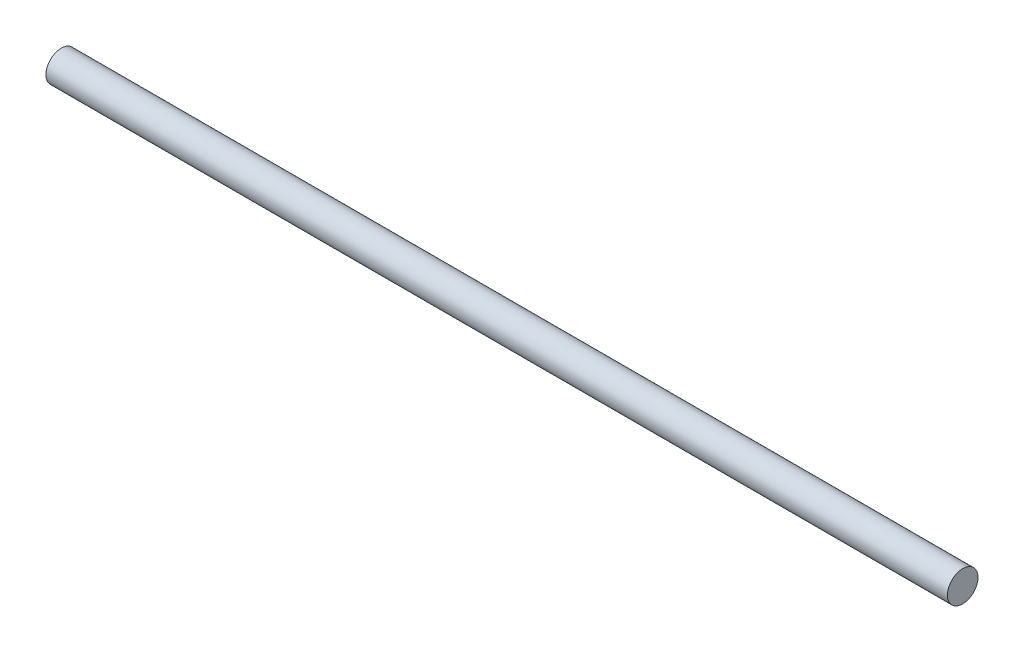
from build123d import *

# Parameters (mm, degrees)
SKETCH1_R           = 1.5
BOSS_EXTRUDE1_DEPTH = 88.49


with BuildPart() as part:
    # Sketch1 → Boss-Extrude1 (new body)
    with BuildSketch(Plane(origin=(0, 0, 0), x_dir=(0, 0, -1), z_dir=(1, 0, 0))):
        Circle(SKETCH1_R)
    extrude(amount=BOSS_EXTRUDE1_DEPTH)


solid = part.part
